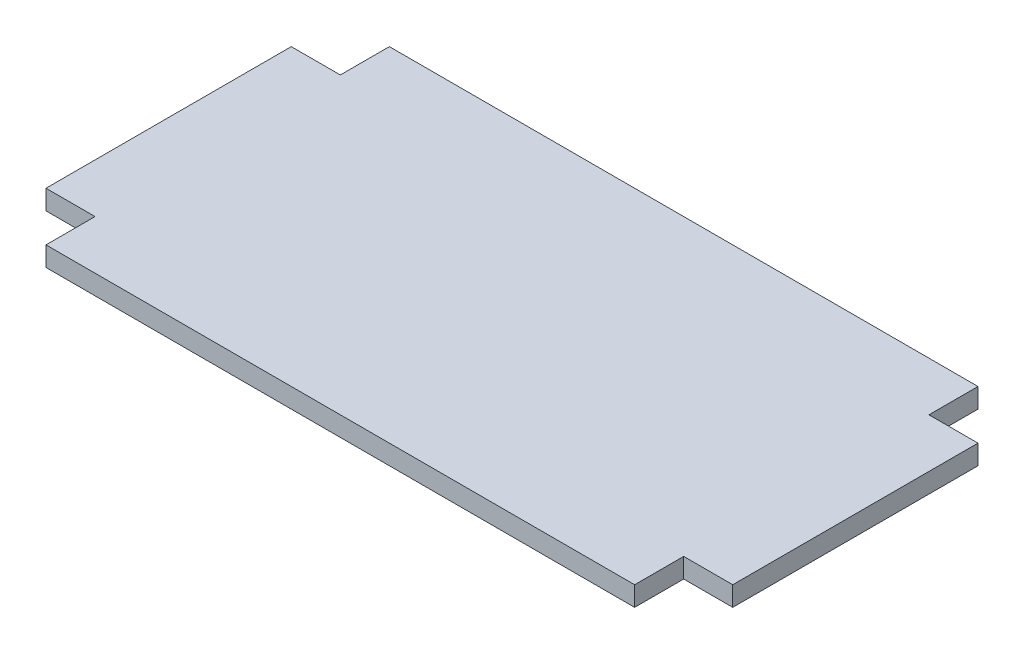
from build123d import *

# Parameters (mm, degrees)
DODANIE_WYCI_GNI_CIE1_DEPTH = 4


with BuildPart() as part:
    # Szkic1 → Dodanie-wyciągnięcie1 (new body)
    with BuildSketch(Plane(origin=(0, 0, 0), x_dir=(1, 0, 0), z_dir=(0, 1, 0))):
        Polygon((-60, -35), (60, -35), (60, -25), (70, -25), (70, 25), (60, 25), (60, 35), (-60, 35), (-60, 25), (-70, 25), (-70, -25), (-60, -25), align=None)
    extrude(amount=DODANIE_WYCI_GNI_CIE1_DEPTH)


solid = part.part
